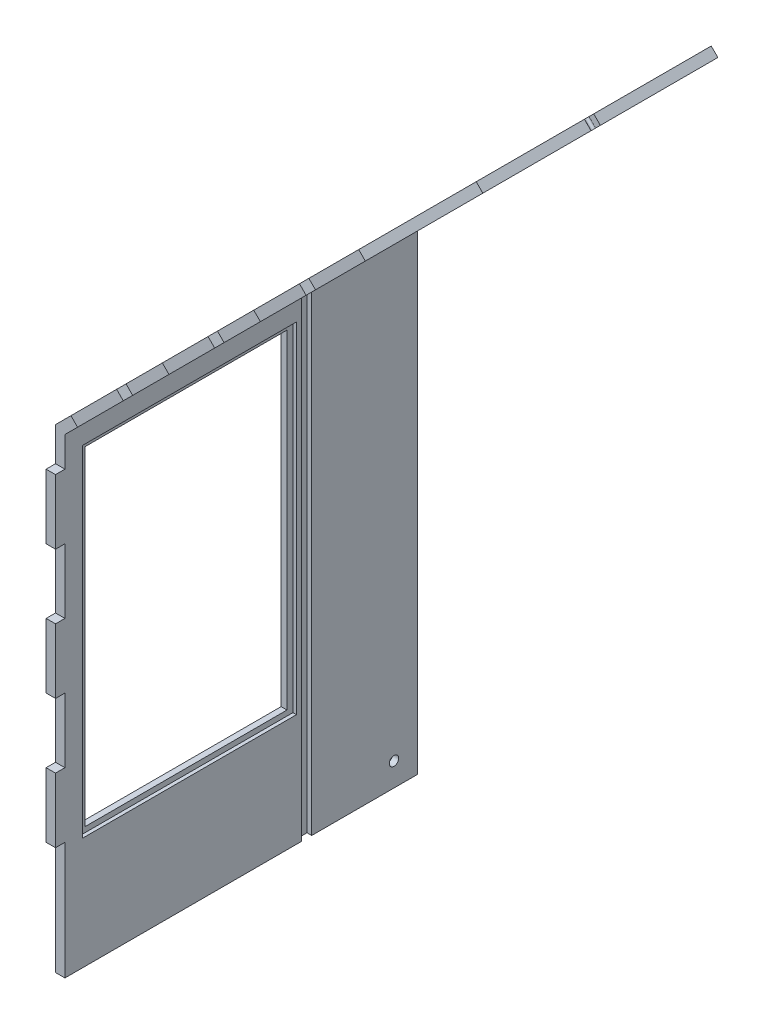
from build123d import *

# Parameters (mm, degrees)
BOSS_EXTRU_1_DEPTH      = 308
ESQUISSE2_W             = 8
ESQUISSE2_H             = 100
ESQUISSE2_H_2           = 55
ENL_V_MAT_EXTRU_1_DEPTH = 8
ESQUISSE3_W             = 172
ESQUISSE3_H             = 280
ENL_V_MAT_EXTRU_2_DEPTH = 532
ESQUISSE4_R             = 1
ESQUISSE4_W             = 199
ESQUISSE4_H             = 275
ENL_V_MAT_EXTRU_3_DEPTH = 8
ESQUISSE5_R             = 1.6
ENL_V_MAT_EXTRU_4_DEPTH = 8
ESQUISSE6_W             = 182
ESQUISSE6_H             = 289.463708499
ENL_V_MAT_EXTRU_5_DEPTH = 3
ESQUISSE7_R             = 4
ENL_V_MAT_EXTRU_6_DEPTH = 5.3
ESQUISSE8_W             = 8.5
ESQUISSE8_H             = 407.758885886
ENL_V_MAT_EXTRU_7_DEPTH = 4
ESQUISSE9_W             = 8.5
ESQUISSE9_H             = 355.689024311
ENL_V_MAT_EXTRU_8_DEPTH = 4


with BuildPart() as part:
    # Esquisse1 → Boss.-Extru.1 (new body)
    with BuildSketch(Plane.XY):
        Polygon((-49.970813456, -42.453670617), (-57.970813456, -42.453670617), (-57.970813456, 361.396329383), (200.029186542, 619.396329381), (205.686040791, 613.739475131), (-49.970813456, 358.082620884), align=None)
    extrude(amount=BOSS_EXTRU_1_DEPTH)

    # Esquisse2 → Enlèv. mat.-Extru.1 (cut)
    with BuildSketch(Plane.XY.offset(308)):
        with Locations((-53.970813456, 7.546329383)):
            Rectangle(ESQUISSE2_W, ESQUISSE2_H)
        Polygon((205.686040791, 613.739475131), (163.25963392, 571.31306826), (157.602779671, 576.96992251), (200.029186542, 619.396329381), align=None)
        with Locations((-53.970813456, 140.046329383)):
            Rectangle(ESQUISSE2_W, ESQUISSE2_H_2)
        with Locations((-53.970813456, 250.046329383)):
            Rectangle(ESQUISSE2_W, ESQUISSE2_H_2)
        Polygon((118.711906706, 538.079049544), (124.368760955, 532.422195295), (85.47788799, 493.53132233), (79.82103374, 499.188176579), align=None)
        Polygon((40.930160775, 460.297303614), (46.587015025, 454.640449364), (7.696142059, 415.749576399), (2.03928781, 421.406430649), align=None)
        Polygon((-36.851585155, 382.515557683), (-31.194730906, 376.858703434), (-49.970813456, 358.082620884), (-49.970813456, 332.546329383), (-57.970813456, 332.546329383), (-57.970813456, 361.396329383), align=None)
    extrude(amount=-ENL_V_MAT_EXTRU_1_DEPTH, mode=Mode.SUBTRACT)

    # Esquisse3 → Enlèv. mat.-Extru.2 (cut)
    with BuildSketch(Plane.ZY.offset(57.970813456)):
        with Locations((194, 197.546329383)):
            Rectangle(ESQUISSE3_W, ESQUISSE3_H)
    extrude(amount=-ENL_V_MAT_EXTRU_2_DEPTH, mode=Mode.SUBTRACT)

    # Esquisse4 → Enlèv. mat.-Extru.3 (cut)
    with BuildSketch(Plane(origin=(-209.683571419, 209.683571419, 0), x_dir=(0, 0, 1), z_dir=(-0.7071067811865465, 0.7071067811865487, 0))):
        with Locations(Location((79.717490694, 533.421338986, 0), (0, 0, 270))):
            Circle(ESQUISSE4_R)
        with Locations(Location((274.912348835, 533.421338986, 0), (0, 0, 270))):
            Circle(ESQUISSE4_R)
        with Locations((180.5, 381.921338986)):
            Rectangle(ESQUISSE4_W, ESQUISSE4_H)
    extrude(amount=-ENL_V_MAT_EXTRU_3_DEPTH, mode=Mode.SUBTRACT)

    # Esquisse5 → Enlèv. mat.-Extru.4 (cut)
    with BuildSketch(Plane(origin=(-209.683571419, 209.683571419, 0), x_dir=(0, 0, 1), z_dir=(-0.7071067811865467, 0.7071067811865485, 0))):
        with Locations(Location((250, 575.421338986, 0), (0, 0, 270))):
            Circle(ESQUISSE5_R)
        with Locations(Location((50, 575.421338986, 0), (0, 0, 90))):
            Circle(ESQUISSE5_R)
        with BuildLine():
            Line((100, 580.669491466), (200, 580.669491466))
            Line((200, 580.669491466), (200, 573.684080686))
            ThreePointArc((200, 573.684080686), (200, 571.421338986), (197.7372583, 571.421338986))
            Line((197.7372583, 571.421338986), (102.2627417, 571.421338986))
            ThreePointArc((102.2627417, 571.421338986), (100, 571.421338986), (100, 573.684080686))
            Line((100, 573.684080686), (100, 580.669491466))
        make_face()
    extrude(amount=-ENL_V_MAT_EXTRU_4_DEPTH, mode=Mode.SUBTRACT)

    # Esquisse6 → Enlèv. mat.-Extru.5 (cut)
    with BuildSketch(Plane(origin=(-49.970813456, 0, 0), x_dir=(0, 0, -1), z_dir=(1, 0, 0))):
        with Locations((-194, 197.814475133)):
            Rectangle(ESQUISSE6_W, ESQUISSE6_H)
    extrude(amount=-ENL_V_MAT_EXTRU_5_DEPTH, mode=Mode.SUBTRACT)

    # Esquisse7 → Enlèv. mat.-Extru.6 (cut)
    with BuildSketch(Plane(origin=(-49.970813456, 0, 0), x_dir=(0, 0, -1), z_dir=(1, 0, 0))):
        with Locations((-20, -22.453670617)):
            Circle(ESQUISSE7_R)
    extrude(amount=-ENL_V_MAT_EXTRU_6_DEPTH, mode=Mode.SUBTRACT)

    # Esquisse8 → Enlèv. mat.-Extru.7 (cut)
    with BuildSketch(Plane(origin=(-49.970813456, 0, 0), x_dir=(0, 0, -1), z_dir=(1, 0, 0))):
        with Locations((-94.25, 155.136885429)):
            Rectangle(ESQUISSE8_W, ESQUISSE8_H)
    extrude(amount=-ENL_V_MAT_EXTRU_7_DEPTH, mode=Mode.SUBTRACT)

    # Esquisse9 → Enlèv. mat.-Extru.8 (cut)
    with BuildSketch(Plane(origin=(-204.02671717, 204.02671717, 0), x_dir=(0, 0, -1), z_dir=(0.7071067811865464, -0.7071067811865487, 0))):
        with Locations((-94.25, 393.576826831)):
            Rectangle(ESQUISSE9_W, ESQUISSE9_H)
    extrude(amount=-ENL_V_MAT_EXTRU_8_DEPTH, mode=Mode.SUBTRACT)


solid = part.part
